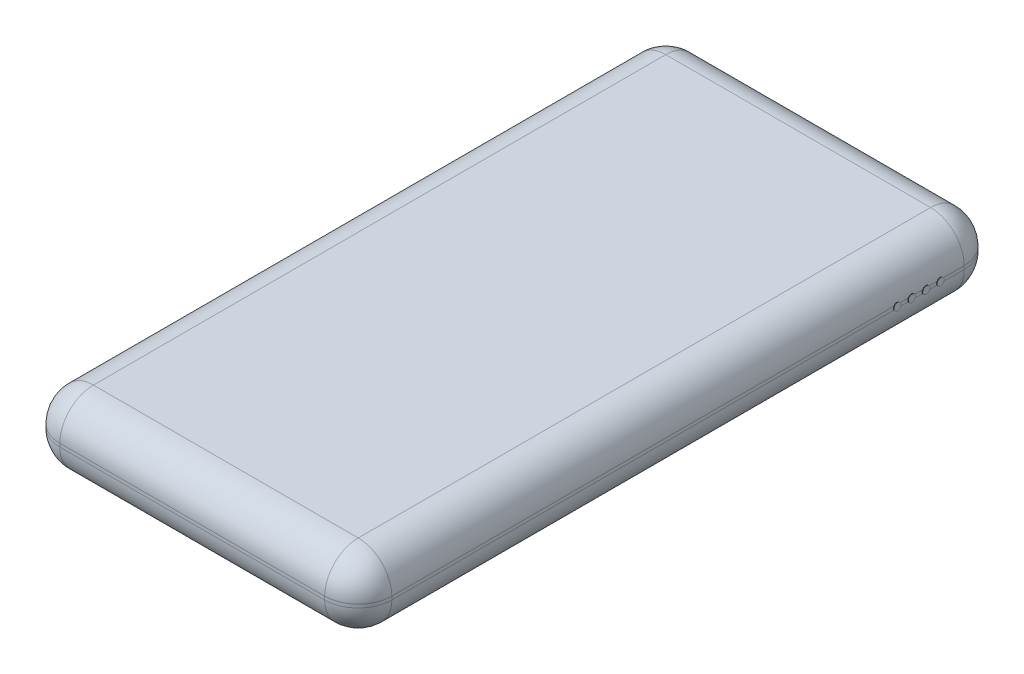
from build123d import *

# Parameters (mm, degrees)
SKETCH1_W           = 69.2
SKETCH1_H           = 133.3
BOSS_EXTRUDE1_DEPTH = 7.35
FILLET1_R           = 7
SKETCH2_W           = 12.4
SKETCH2_H           = 5
CUT_EXTRUDE1_DEPTH  = 10
CUT_EXTRUDE2_DEPTH  = 0.2
BOSS_EXTRUDE2_START = -0.011437
SKETCH4_R           = 0.75
BOSS_EXTRUDE2_DEPTH = 0.111437
SKETCH5_W           = 0.583333333
SKETCH5_H           = 0.534722222
BOSS_EXTRUDE3_DEPTH = 0.1


with BuildPart() as part:
    # Sketch1 → Boss-Extrude1 (new, symmetric)
    with BuildSketch(Plane(origin=(0, 0, 0), x_dir=(1, 0, 0), z_dir=(0, 1, 0))):
        Rectangle(SKETCH1_W, SKETCH1_H)
    extrude(amount=BOSS_EXTRUDE1_DEPTH, both=True)

    # Fillet1
    fillet1_edges = [part.edges().sort_by_distance(p)[0] for p in [
        (-34.6, 7.35, 0),
        (0, 7.35, 66.65),
        (34.6, 7.35, 0),
        (0, -7.35, 66.65),
        (-34.6, -7.35, 0),
        (0, -7.35, -66.65),
        (34.6, -7.35, 0),
        (34.6, 0, 66.65),
        (-34.6, 0, 66.65),
        (-34.6, 0, -66.65),
        (34.6, 0, -66.65),
        (0, 7.35, -66.65),
    ]]
    fillet(fillet1_edges, radius=FILLET1_R)

    # Sketch2 → Cut-Extrude1 (cut)
    with BuildSketch(Plane(origin=(0, 0, -66.65), x_dir=(-1, 0, 0), z_dir=(0, 0, -1))):
        with BuildLine():
            Line((-2.8, 1.4), (2.8, 1.4))
            ThreePointArc((2.8, 1.4), (4.2, 0), (2.8, -1.4))
            Line((2.8, -1.4), (-2.8, -1.4))
            ThreePointArc((-2.8, -1.4), (-4.2, 0), (-2.8, 1.4))
        make_face()
        with Locations((16, 0.15)):
            Rectangle(SKETCH2_W, SKETCH2_H)
        with Locations((-16, 0.15)):
            Rectangle(SKETCH2_W, SKETCH2_H)
    extrude(amount=-CUT_EXTRUDE1_DEPTH, mode=Mode.SUBTRACT)

    # Sketch3 → Cut-Extrude2 (cut)
    with BuildSketch(Plane.ZY.offset(34.6)):
        with BuildLine():
            Line((-56.6, 1.85), (-50.1, 1.85))
            ThreePointArc((-50.1, 1.85), (-48.25, 0), (-50.1, -1.85))
            Line((-50.1, -1.85), (-56.6, -1.85))
            ThreePointArc((-56.6, -1.85), (-58.45, 0), (-56.6, 1.85))
        make_face()
        with BuildLine():
            Line((-56.6, 1.75), (-50.1, 1.75))
            ThreePointArc((-50.1, 1.75), (-48.35, 0), (-50.1, -1.75))
            Line((-50.1, -1.75), (-56.6, -1.75))
            ThreePointArc((-56.6, -1.75), (-58.35, 0), (-56.6, 1.75))
        make_face(mode=Mode.SUBTRACT)
    extrude(amount=-CUT_EXTRUDE2_DEPTH, mode=Mode.SUBTRACT)


with BuildPart() as boss_extrude2_tool:
    # Sketch4 → Boss-Extrude2 (new body)
    with BuildSketch(Plane(origin=(34.6, 0, 0), x_dir=(0, 0, -1), z_dir=(1, 0, 0)).offset(BOSS_EXTRUDE2_START)):
        with Locations(Location((54.65, 0, 0), (0, 0, 152.181860715))):
            Circle(SKETCH4_R)
        with Locations(Location((51.65, 0, 0), (0, 0, 152.181860715))):
            Circle(SKETCH4_R)
        with Locations(Location((48.65, 0, 0), (0, 0, 207.818139285))):
            Circle(SKETCH4_R)
        with Locations(Location((45.65, 0, 0), (0, 0, 207.818139285))):
            Circle(SKETCH4_R)
    extrude(amount=BOSS_EXTRUDE2_DEPTH)


with BuildPart() as part_1:
    add(part.part)


with BuildPart() as part_2:
    # Boss-Extrude2: joined with boss_extrude2_tool
    add(part_1.part.fuse(boss_extrude2_tool.part, tol=0.00001))

    # Sketch5 → Boss-Extrude3 (add)
    # profile 1 of 7: a face of its own
    with BuildSketch(Plane.XZ.offset(7.35)):
        with BuildLine():
            Line((-1.75, 25.23125), (-0.663085937, 25.23125))
            add(Edge.make_bspline(
                [(-0.663085937, 25.23125), (-0.679911307, 25.245807573), (-0.713306836, 25.274701906), (-0.756631795, 25.324512717), (-0.793980193, 25.379046779), (-0.822880961, 25.439324306), (-0.847114269, 25.503714977), (-0.863412202, 25.573138415), (-0.87359048, 25.647430418), (-0.874520626, 25.698590162), (-0.875, 25.724956597)],
                knots=[0, 0, 0, 0, 0.957888067, 1.901246656, 2.836428703, 3.797790987, 4.774817171, 5.796406202, 6.864323638, 8, 8, 8, 8], degree=3))
            add(Edge.make_bspline(
                [(-0.875, 25.724956597), (-0.874521219, 25.753088579), (-0.873603482, 25.807012555), (-0.86380859, 25.884193521), (-0.846999382, 25.953899211), (-0.824726351, 26.016443205), (-0.795380017, 26.071505739), (-0.759839655, 26.11936478), (-0.716162, 26.158339323), (-0.665930546, 26.191851196), (-0.604270804, 26.217259512), (-0.531223458, 26.239577792), (-0.444766886, 26.259572716), (-0.344338411, 26.273750637), (-0.230334072, 26.28584881), (-0.102659797, 26.294848522), (0.038692085, 26.300084025), (0.137473553, 26.300484849), (0.189127604, 26.300694444)],
                knots=[0, 0, 0, 0, 0.961136129, 1.842326004, 2.652458552, 3.408023086, 4.104866356, 4.778099452, 5.433523761, 6.095936885, 6.832227735, 7.702558891, 8.705927532, 9.861195434, 11.166548768, 12.624001503, 14.234648633, 16, 16, 16, 16], degree=3))
            Line((0.189127604, 26.300694444), (0.698025174, 26.300694444))
            add(Edge.make_bspline(
                [(0.698025174, 26.300694444), (0.740572283, 26.30034567), (0.822954902, 26.299670349), (0.942354594, 26.291982468), (1.053463704, 26.279402754), (1.156137299, 26.261101252), (1.250935385, 26.23860088), (1.337664947, 26.210703418), (1.416409627, 26.177443531), (1.486548281, 26.138559851), (1.54893475, 26.095313849), (1.602584867, 26.046074379), (1.648572913, 25.992310651), (1.685572671, 25.932508129), (1.714516158, 25.867879456), (1.734657883, 25.798049255), (1.748481107, 25.723474996), (1.749482812, 25.671855536), (1.75, 25.645203993)],
                knots=[0, 0, 0, 0, 1.458497956, 2.82404334, 4.099907523, 5.290101602, 6.397493015, 7.437844582, 8.410060312, 9.323128096, 10.182857568, 11.006146039, 11.813026712, 12.600627911, 13.408814821, 14.232743664, 15.087551315, 16, 16, 16, 16], degree=3))
            add(Edge.make_bspline(
                [(1.75, 25.645203993), (1.749064933, 25.614276821), (1.747271353, 25.554954487), (1.735311498, 25.469473429), (1.714295375, 25.391774934), (1.684389327, 25.321745635), (1.646536361, 25.259033703), (1.598137018, 25.205852988), (1.543451487, 25.157900612), (1.500629679, 25.134527317), (1.478841146, 25.122634549)],
                knots=[0, 0, 0, 0, 1.191838246, 2.286100546, 3.3181705, 4.284199703, 5.212997062, 6.125402743, 7.046170002, 8, 8, 8, 8], degree=3))
            Line((1.478841146, 25.122634549), (1.75, 24.999587674))
            Line((1.75, 24.999587674), (1.75, 24.696527778))
            Line((1.75, 24.696527778), (-1.166666667, 24.696527778))
            Line((-1.166666667, 24.696527778), (-1.166666667, 24.502083333))
            Line((-1.166666667, 24.502083333), (-1.75, 24.502083333))
            Line((-1.75, 24.502083333), (-1.75, 25.23125))
        make_face()
        with BuildLine():
            add(Edge.make_bspline(
                [(-0.194444444, 25.525195313), (-0.194146952, 25.51525202), (-0.193555881, 25.495496273), (-0.184527248, 25.467297047), (-0.171565673, 25.441093439), (-0.15354182, 25.416652681), (-0.129537774, 25.395139909), (-0.101212249, 25.37400244), (-0.066869256, 25.35635703), (-0.027663056, 25.34032518), (0.016357372, 25.326287231), (0.065308019, 25.312689483), (0.11994754, 25.303985482), (0.179285909, 25.294188312), (0.243963371, 25.28762482), (0.313902329, 25.283368337), (0.388857836, 25.28004239), (0.440534206, 25.279922696), (0.467122396, 25.279861111)],
                knots=[0, 0, 0, 0, 0.619752658, 1.23135032, 1.833641643, 2.445239305, 3.117828794, 3.843559376, 4.65161798, 5.525498961, 6.492519773, 7.54171784, 8.700952357, 9.951346655, 11.30563929, 12.766410314, 14.336274486, 16, 16, 16, 16], degree=3))
            add(Edge.make_bspline(
                [(0.467122396, 25.279861111), (0.514243573, 25.280460979), (0.602314282, 25.281582148), (0.724931936, 25.29290041), (0.829170107, 25.310267942), (0.915009523, 25.334975329), (0.982851821, 25.368190019), (1.032309289, 25.409826986), (1.064718909, 25.460754312), (1.067872464, 25.498689787), (1.069444444, 25.517599826)],
                knots=[0, 0, 0, 0, 1.600328052, 2.991054911, 4.178838534, 5.18553721, 6.016394776, 6.723546431, 7.36371463, 8, 8, 8, 8], degree=3))
            add(Edge.make_bspline(
                [(1.069444444, 25.517599826), (1.068634175, 25.532640579), (1.067072073, 25.561637344), (1.053265608, 25.602257088), (1.029187007, 25.636245862), (0.996507816, 25.664281344), (0.9536715, 25.684538278), (0.90267563, 25.699335678), (0.84264667, 25.708331525), (0.799837589, 25.709266981), (0.777018229, 25.709765625)],
                knots=[0, 0, 0, 0, 0.909956367, 1.754286559, 2.558778603, 3.407558524, 4.333925683, 5.406789015, 6.617690149, 8, 8, 8, 8], degree=3))
            Line((0.777018229, 25.709765625), (0.560546875, 25.713563368))
            Line((0.560546875, 25.713563368), (0.365342882, 25.717361111))
            Line((0.365342882, 25.717361111), (0.171657986, 25.713563368))
            Line((0.171657986, 25.713563368), (0.001519097, 25.709765625))
            add(Edge.make_bspline(
                [(0.001519097, 25.709765625), (-0.013707892, 25.709161509), (-0.042641605, 25.708013592), (-0.083157679, 25.700101647), (-0.11785886, 25.68562016), (-0.145769536, 25.6643246), (-0.168815416, 25.638160672), (-0.18369379, 25.605102454), (-0.193047665, 25.566984071), (-0.193959936, 25.539690796), (-0.194444444, 25.525195313)],
                knots=[0, 0, 0, 0, 1.184935655, 2.251567061, 3.195978099, 4.082711506, 4.963293071, 5.87995498, 6.874042107, 8, 8, 8, 8], degree=3))
        make_face(mode=Mode.SUBTRACT)
    # profile 2 of 7: a face of its own
    with BuildSketch(Plane.XZ.offset(7.35)):
        with BuildLine():
            add(Edge.make_bspline(
                [(0.631944444, 28.191970486), (0.657261094, 28.192793537), (0.710418134, 28.194521686), (0.793723438, 28.195913167), (0.884112994, 28.196700445), (0.946650573, 28.196586714), (0.97905816, 28.196527778)],
                knots=[0, 0, 0, 0, 0.875538234, 1.838356296, 2.87981503, 4, 4, 4, 4], degree=3))
            add(Edge.make_bspline(
                [(0.97905816, 28.196527778), (1.010220817, 28.19593228), (1.070636811, 28.19477777), (1.158180985, 28.186253915), (1.239838151, 28.173050561), (1.315303635, 28.153225), (1.384924216, 28.127995294), (1.449091882, 28.098144954), (1.50645552, 28.061178299), (1.558019802, 28.018960468), (1.60379326, 27.97125301), (1.642611649, 27.917169002), (1.676463756, 27.858342561), (1.703839195, 27.793587004), (1.723888618, 27.723044201), (1.739280276, 27.647419979), (1.748356018, 27.566069436), (1.749441563, 27.509918633), (1.75, 27.481032986)],
                knots=[0, 0, 0, 0, 1.239763479, 2.403567251, 3.49663674, 4.527788701, 5.502944472, 6.440210388, 7.337253692, 8.210506107, 9.086948655, 9.959445334, 10.852861, 11.782789339, 12.748690815, 13.766170095, 14.850851307, 16, 16, 16, 16], degree=3))
            add(Edge.make_bspline(
                [(1.75, 27.481032986), (1.749489635, 27.440988659), (1.748514337, 27.364464738), (1.735254744, 27.255453058), (1.715002443, 27.157517486), (1.68770189, 27.069965538), (1.650182087, 26.994096957), (1.604978531, 26.928901191), (1.551265601, 26.874714453), (1.486492793, 26.831051847), (1.407272094, 26.796901836), (1.31073627, 26.767572992), (1.194071221, 26.744507227), (1.057746343, 26.723965324), (0.90106508, 26.708562329), (0.72423701, 26.697508395), (0.527179314, 26.690723439), (0.389147787, 26.689975649), (0.316731771, 26.689583333)],
                knots=[0, 0, 0, 0, 1.000743611, 1.912401349, 2.740556033, 3.499310398, 4.198610993, 4.848451647, 5.475154145, 6.094976305, 6.789186409, 7.624184666, 8.613732483, 9.759737736, 11.070610629, 12.548705848, 14.189334145, 16, 16, 16, 16], degree=3))
            add(Edge.make_bspline(
                [(0.316731771, 26.689583333), (0.261275385, 26.689925247), (0.1548625, 26.69058133), (0.002314306, 26.69814246), (-0.136363295, 26.710684705), (-0.261115028, 26.72876421), (-0.372253301, 26.751334496), (-0.470290679, 26.777826849), (-0.554027321, 26.811148355), (-0.625736887, 26.849401653), (-0.685583588, 26.896130289), (-0.736705852, 26.951340218), (-0.780002581, 27.015352483), (-0.814965067, 27.088686394), (-0.842483341, 27.170513094), (-0.860554946, 27.261664055), (-0.873355197, 27.361423752), (-0.87443716, 27.431110093), (-0.875, 27.467361111)],
                knots=[0, 0, 0, 0, 1.604324723, 3.078470016, 4.41742246, 5.631517139, 6.723310252, 7.697286906, 8.565105791, 9.325671848, 10.040713072, 10.750784488, 11.494370848, 12.267531073, 13.094477428, 13.985180126, 14.95188541, 16, 16, 16, 16], degree=3))
            add(Edge.make_bspline(
                [(-0.875, 27.467361111), (-0.874488329, 27.503362891), (-0.873504531, 27.572584079), (-0.86001347, 27.671679171), (-0.840099055, 27.762265842), (-0.811108075, 27.843798298), (-0.774985316, 27.917348503), (-0.728509938, 27.980764528), (-0.675119907, 28.03646314), (-0.611547725, 28.083117363), (-0.536854816, 28.122033844), (-0.449582696, 28.155160382), (-0.348494752, 28.182715284), (-0.23389363, 28.206330635), (-0.105125263, 28.222955897), (0.03726931, 28.235676764), (0.193578559, 28.244391703), (0.30254096, 28.24488308), (0.359266493, 28.245138889)],
                knots=[0, 0, 0, 0, 1.020083796, 1.961331111, 2.83037502, 3.645558624, 4.40970091, 5.144968609, 5.865901539, 6.589581706, 7.370008304, 8.247286702, 9.231471158, 10.338145754, 11.562621833, 12.910675808, 14.391706121, 16, 16, 16, 16], degree=3))
            Line((0.359266493, 28.245138889), (0.534722222, 28.238302951))
            Line((0.534722222, 28.238302951), (0.534722222, 27.259244792))
            Line((0.534722222, 27.259244792), (0.778537326, 27.272916667))
            Line((0.778537326, 27.272916667), (0.896267361, 27.271397569))
            add(Edge.make_bspline(
                [(0.896267361, 27.271397569), (0.908782963, 27.277758127), (0.935668241, 27.291421503), (0.960175025, 27.336390841), (0.971878728, 27.395232838), (0.972098402, 27.439417754), (0.972222222, 27.464322917)],
                knots=[0, 0, 0, 0, 0.747926972, 1.606652651, 2.650971674, 4, 4, 4, 4], degree=3))
            add(Edge.make_bspline(
                [(0.972222222, 27.464322917), (0.971186695, 27.479567719), (0.969226367, 27.508427246), (0.959008677, 27.548789459), (0.940783638, 27.582490555), (0.916886577, 27.610835481), (0.885372625, 27.632467635), (0.847464465, 27.647396254), (0.803523951, 27.656537527), (0.772255912, 27.657499846), (0.755750868, 27.658007813)],
                knots=[0, 0, 0, 0, 1.107559938, 2.096692046, 2.992389266, 3.865001064, 4.761827552, 5.733929593, 6.803839554, 8, 8, 8, 8], degree=3))
            Line((0.755750868, 27.658007813), (0.681315104, 27.658007813))
            Line((0.681315104, 27.658007813), (0.631944444, 27.661805556))
            Line((0.631944444, 27.661805556), (0.631944444, 28.191970486))
        make_face()
        with BuildLine():
            Line((0.243055556, 27.247851563), (0.243055556, 27.661805556))
            Line((0.243055556, 27.661805556), (0.048611111, 27.661805556))
            add(Edge.make_bspline(
                [(0.048611111, 27.661805556), (0.029573773, 27.661327186), (-0.006217591, 27.660427823), (-0.056030203, 27.651156477), (-0.098780138, 27.63722507), (-0.134058195, 27.616468996), (-0.16166484, 27.589116518), (-0.181024707, 27.555278356), (-0.192534833, 27.515690497), (-0.193788934, 27.487442825), (-0.194444444, 27.472677951)],
                knots=[0, 0, 0, 0, 1.299183268, 2.442544312, 3.449095453, 4.35686234, 5.21306271, 6.073446493, 6.993003055, 8, 8, 8, 8], degree=3))
            add(Edge.make_bspline(
                [(-0.194444444, 27.472677951), (-0.193715855, 27.456849224), (-0.192332558, 27.426796871), (-0.177904784, 27.385204496), (-0.155419556, 27.349280715), (-0.122186066, 27.321093889), (-0.080797154, 27.298800886), (-0.030591648, 27.283087228), (0.028560712, 27.274417039), (0.070861041, 27.273438585), (0.093424479, 27.272916667)],
                knots=[0, 0, 0, 0, 0.951870258, 1.807216776, 2.62530471, 3.480651227, 4.403877865, 5.447718649, 6.638586401, 8, 8, 8, 8], degree=3))
            add(Edge.make_bspline(
                [(0.093424479, 27.272916667), (0.116067542, 27.271577791), (0.16680088, 27.268577947), (0.21588077, 27.255237799), (0.243055556, 27.247851563)],
                knots=[0, 0, 0, 0, 0.892630527, 2, 2, 2, 2], degree=3))
        make_face(mode=Mode.SUBTRACT)
    # profile 3 of 7: a face of its own
    with BuildSketch(Plane.XZ.offset(7.35)):
        Polygon((1.020833333, 29.265972222), (1.020833333, 29.509027778), (1.75, 29.509027778), (1.75, 28.536805556), (1.020833333, 28.536805556), (1.020833333, 28.73125), (-1.069444444, 28.73125), (-1.069444444, 28.536805556), (-1.75, 28.536805556), (-1.75, 29.265972222), align=None)
    # profile 4 of 7: a face of its own
    with BuildSketch(Plane.XZ.offset(7.35)):
        Polygon((-0.875, 31.696527778), (-0.194444444, 31.696527778), (-0.194444444, 31.483094618), (0.192165799, 31.082052951), (1.020833333, 31.524869792), (1.020833333, 31.696527778), (1.75, 31.696527778), (1.75, 30.772916667), (1.020833333, 30.772916667), (1.020833333, 30.990147569), (0.487630208, 30.718229167), (0.679796007, 30.432638889), (1.020833333, 30.432638889), (1.020833333, 30.627083333), (1.75, 30.627083333), (1.75, 29.703472222), (1.020833333, 29.703472222), (1.020833333, 29.897916667), (-1.166666667, 29.897916667), (-1.166666667, 29.703472222), (-1.75, 29.703472222), (-1.75, 30.432638889), (0.277235243, 30.432638889), (-0.194444444, 30.990147569), (-0.194444444, 30.772916667), (-0.875, 30.772916667), align=None)
    # profile 5 of 7: a face of its own
    with BuildSketch(Plane.XZ.offset(7.35)):
        Polygon((-0.875, 32.717361111), (1.020833333, 32.717361111), (1.020833333, 32.960416667), (1.75, 32.960416667), (1.75, 31.988194444), (1.020833333, 31.988194444), (1.020833333, 32.182638889), (-0.194444444, 32.182638889), (-0.194444444, 31.988194444), (-0.875, 31.988194444), align=None)
    # profile 6 of 7: a face of its own
    with BuildSketch(Plane.XZ.offset(7.35)):
        with Locations((-1.458333334, 32.401388889)):
            Rectangle(SKETCH5_W, SKETCH5_H)
    # profile 7 of 7: a face of its own
    with BuildSketch(Plane.XZ.offset(7.35)):
        with BuildLine():
            Line((1.020833333, 35.147916667), (1.75, 35.147916667))
            Line((1.75, 35.147916667), (1.75, 34.224305556))
            Line((1.75, 34.224305556), (1.020833333, 34.224305556))
            Line((1.020833333, 34.224305556), (1.020833333, 34.370138889))
            Line((1.020833333, 34.370138889), (0.245334201, 34.370138889))
            Line((0.245334201, 34.370138889), (0.157226562, 34.370138889))
            Line((0.157226562, 34.370138889), (0.046332465, 34.366341146))
            add(Edge.make_bspline(
                [(0.046332465, 34.366341146), (0.027568865, 34.365753052), (-0.007886252, 34.364641808), (-0.057330481, 34.356681509), (-0.099389154, 34.342886651), (-0.1346708, 34.324409676), (-0.161588589, 34.298021545), (-0.18069196, 34.266395403), (-0.192682112, 34.229177268), (-0.193835342, 34.202628864), (-0.194444444, 34.188606771)],
                knots=[0, 0, 0, 0, 1.322188865, 2.498366973, 3.51391563, 4.43235643, 5.277706131, 6.134463567, 7.014678066, 8, 8, 8, 8], degree=3))
            add(Edge.make_bspline(
                [(-0.194444444, 34.188606771), (-0.193450868, 34.16459222), (-0.191552046, 34.118698057), (-0.168180579, 34.055023677), (-0.131494372, 34.000599115), (-0.079442715, 33.95644807), (-0.013021132, 33.923042689), (0.067140047, 33.90046978), (0.161003344, 33.88587978), (0.228307209, 33.884673359), (0.264322917, 33.884027778)],
                knots=[0, 0, 0, 0, 0.920155783, 1.758508, 2.572028247, 3.42179862, 4.354458765, 5.41193183, 6.615070515, 8, 8, 8, 8], degree=3))
            Line((0.264322917, 33.884027778), (1.020833333, 33.884027778))
            Line((1.020833333, 33.884027778), (1.020833333, 34.078472222))
            Line((1.020833333, 34.078472222), (1.75, 34.078472222))
            Line((1.75, 34.078472222), (1.75, 33.154861111))
            Line((1.75, 33.154861111), (1.020833333, 33.154861111))
            Line((1.020833333, 33.154861111), (1.020833333, 33.349305556))
            Line((1.020833333, 33.349305556), (-0.194444444, 33.349305556))
            Line((-0.194444444, 33.349305556), (-0.194444444, 33.154861111))
            Line((-0.194444444, 33.154861111), (-0.875, 33.154861111))
            Line((-0.875, 33.154861111), (-0.875, 33.884027778))
            Line((-0.875, 33.884027778), (-0.565863715, 33.884027778))
            add(Edge.make_bspline(
                [(-0.565863715, 33.884027778), (-0.590366543, 33.901181055), (-0.638378076, 33.934791673), (-0.701169007, 33.993692947), (-0.75530761, 34.056208759), (-0.798856268, 34.123876109), (-0.833554099, 34.195682247), (-0.85780828, 34.272399869), (-0.872700651, 34.353606936), (-0.874223229, 34.409317118), (-0.875, 34.437738715)],
                knots=[0, 0, 0, 0, 1.081436536, 2.118997371, 3.107052636, 4.067915813, 5.022992717, 5.985209746, 6.972116826, 8, 8, 8, 8], degree=3))
            add(Edge.make_bspline(
                [(-0.875, 34.437738715), (-0.873719366, 34.474327544), (-0.871298251, 34.543500949), (-0.848634417, 34.640488836), (-0.809849704, 34.723232287), (-0.753919121, 34.790733243), (-0.683009747, 34.843643262), (-0.596263406, 34.88001324), (-0.494684526, 34.900834277), (-0.422160705, 34.903462617), (-0.383572049, 34.904861111)],
                knots=[0, 0, 0, 0, 1.128955158, 2.134358331, 3.054363968, 3.926586567, 4.815068339, 5.760907856, 6.808618242, 8, 8, 8, 8], degree=3))
            Line((-0.383572049, 34.904861111), (-0.194444444, 34.904861111))
            Line((-0.194444444, 34.904861111), (1.020833333, 34.904861111))
            Line((1.020833333, 34.904861111), (1.020833333, 35.147916667))
        make_face()
    extrude(amount=BOSS_EXTRUDE3_DEPTH)


solid = part_2.part
